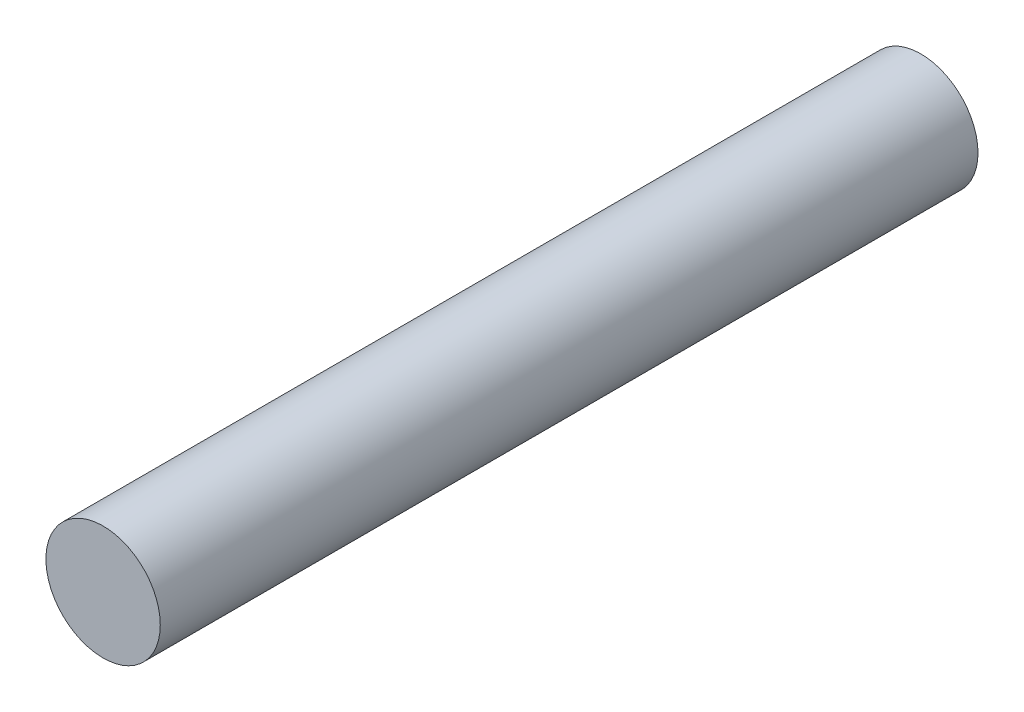
from build123d import *

# Parameters (mm, degrees)
SKETCH1_R           = 3.175
BOSS_EXTRUDE1_DEPTH = 45.3946


with BuildPart() as part:
    # Sketch1 → Boss-Extrude1 (new body)
    with BuildSketch(Plane.XY):
        Circle(SKETCH1_R)
    extrude(amount=BOSS_EXTRUDE1_DEPTH)


solid = part.part
